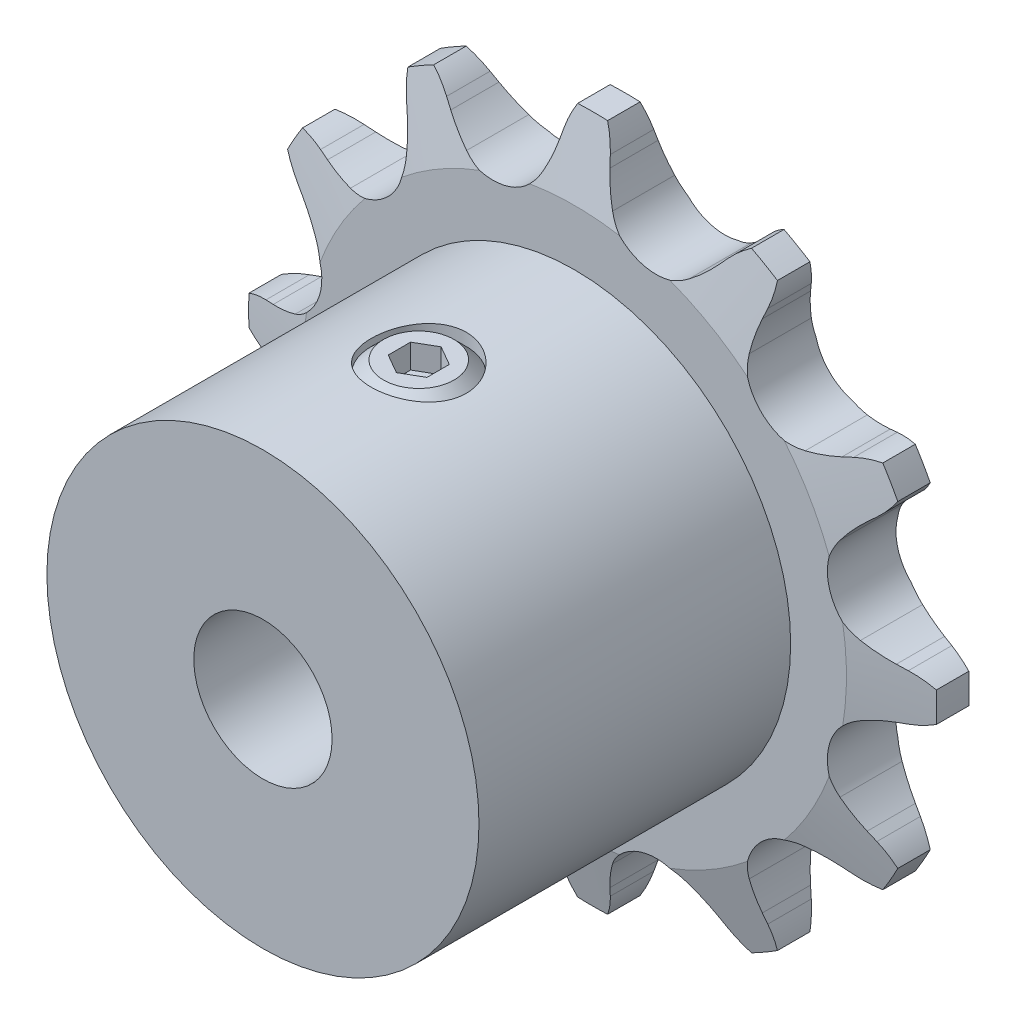
from build123d import *

# Parameters (mm, degrees)
CUT_EXTRUDE1_DEPTH      = 12.503343379
CIRPATTERN1_COUNT       = 12
BOSS_EXTRUDE1_START     = 0.7874
SKETCH2_R               = 4.9609375
BOSS_EXTRUDE1_DEPTH     = 7.15645
CUT_EXTRUDE2_DEPTH      = 14.957494983
CUT_EXTRUDE2_DEPTH_BACK = 14.957494983
SKETCH3_OUTSIDE_W       = 23.142
SKETCH3_OUTSIDE_H       = 23.142
SKETCH3_OUTSIDE_R       = 7.8994
SKETCH3_OUTSIDE_R_2     = 1.5875
CUT_EXTRUDE3_REACH      = 19.056
CUT_EXTRUDE3_END_RADIUS = 1.5875
SKETCH5_R               = 1.0922
CUT_EXTRUDE4_DEPTH      = 0.555625


with BuildPart() as part:
    # Sketch1 → Revolve1 (revolve)
    with BuildSketch(Plane(origin=(0, 0, 0), x_dir=(0, 0, -1), z_dir=(1, 0, 0))):
        Polygon((0.7874, 0), (-0.7874, 0), (-0.7874, 6.241764175), (-0.3190875, 8.115014175), (0.3190875, 8.115014175), (0.7874, 6.241764175), align=None)
    revolve(axis=Axis((0, 0, -0.7874), (0, 0, 1)))

    # Sketch0 → Cut-Extrude1 (cut, symmetric)
    with BuildSketch(Plane.XY):
        with BuildLine():
            Line((3.226896237, -6.652760531), (3.077033423, -6.48436105))
            ThreePointArc((3.077033423, -6.48436105), (2.829061797, -6.236389424), (2.553979118, -6.018882242))
            ThreePointArc((2.553979118, -6.018882242), (1.566079675, -5.844688916), (0.797630324, -6.489494483))
            ThreePointArc((0.797630324, -6.489494483), (0.668155326, -6.815402568), (0.577391412, -7.154138108))
            Line((0.577391412, -7.154138108), (0.531806149, -7.374907744))
            ThreePointArc((0.531806149, -7.374907744), (-0.271419329, -8.568557947), (-1.681167216, -8.855930299))
            ThreePointArc((-1.681167216, -8.855930299), (2.333018254, -8.70694266), (5.883898667, -6.828877005))
            ThreePointArc((5.883898667, -6.828877005), (4.519335007, -7.284879191), (3.226896237, -6.652760531))
        make_face()
    cut_extrude1 = extrude(amount=CUT_EXTRUDE1_DEPTH, both=True, mode=Mode.SUBTRACT)

    # CirPattern1: Cut-Extrude1 ×12 about axis
    cirpattern1_axis = Axis((0, 0, 0), (0, 0, 1))
    for i in range(1, CIRPATTERN1_COUNT):
        add(cut_extrude1.rotate(cirpattern1_axis, i * 360 / CIRPATTERN1_COUNT), mode=Mode.SUBTRACT)

    # Sketch2 → Boss-Extrude1 (add)
    with BuildSketch(Plane.XY.offset(BOSS_EXTRUDE1_START)):
        with Locations(Location((0, 0, 0), (0, 0, 270))):
            Circle(SKETCH2_R)
    extrude(amount=BOSS_EXTRUDE1_DEPTH)

    # Sketch3 outside → Cut-Extrude2 (cut, two sides: drawn at the far end of the back side and taken through both)
    # profile 1 of 2: a face of its own
    with BuildSketch(Plane.XY.offset(-CUT_EXTRUDE2_DEPTH_BACK)):
        Rectangle(SKETCH3_OUTSIDE_W, SKETCH3_OUTSIDE_H)
        Circle(SKETCH3_OUTSIDE_R, mode=Mode.SUBTRACT)
    # profile 2 of 2: a face of its own
    with BuildSketch(Plane.XY.offset(-CUT_EXTRUDE2_DEPTH_BACK)):
        Circle(SKETCH3_OUTSIDE_R_2)
    extrude(amount=CUT_EXTRUDE2_DEPTH + CUT_EXTRUDE2_DEPTH_BACK, mode=Mode.SUBTRACT)

    # Cut-Extrude3: up to this cylinder (the profile starts outside it)
    cut_extrude3_end = Plane(origin=(0, 0, 4.365625), z_dir=(0, 0, -1)) * Cylinder(CUT_EXTRUDE3_END_RADIUS, 42.287, mode=Mode.PRIVATE)
    # Sketch5 → Cut-Extrude3 (cut, up to the surface)
    with BuildSketch(Plane(origin=(0, 4.9609375, 0), x_dir=(-1, 0, 0), z_dir=(0, 1, 0)), mode=Mode.PRIVATE) as cut_extrude3_sk1:
        with Locations(Location((0, 4.365625, 0), (0, 0, 90))):
            Circle(SKETCH5_R)
    cut_extrude3_tool1 = extrude(cut_extrude3_sk1.sketch, amount=-CUT_EXTRUDE3_REACH, mode=Mode.PRIVATE) - cut_extrude3_end
    add(cut_extrude3_tool1.solids().sort_by_distance((0, 4.960938, 4.365625))[0], mode=Mode.SUBTRACT)


with BuildPart() as body_2:
    # Sketch6 → Revolve2 (revolve)
    with BuildSketch(Plane(origin=(0, 0, 0), x_dir=(0, 0, -1), z_dir=(1, 0, 0))):
        Polygon((-4.365625, 4.9609375), (-4.365625, 1.5875), (-5.174342857, 1.5875), (-5.457825, 1.870982143), (-5.457825, 4.677455357), (-5.174342857, 4.9609375), align=None)
    revolve(axis=Axis((0, 1.5875, 4.365625), (0, -1, 0)))

    # Sketch7 → Cut-Extrude4 (cut)
    with BuildSketch(Plane(origin=(0, 4.9609375, 0), x_dir=(1, 0, 0), z_dir=(0, 1, 0))):
        Polygon((0, -3.852360611), (-0.4445, -4.108992805), (-0.4445, -4.622257195), (0, -4.878889389), (0.4445, -4.622257195), (0.4445, -4.108992805), align=None)
    extrude(amount=-CUT_EXTRUDE4_DEPTH, mode=Mode.SUBTRACT)


solid = Compound([part.part, body_2.part])
